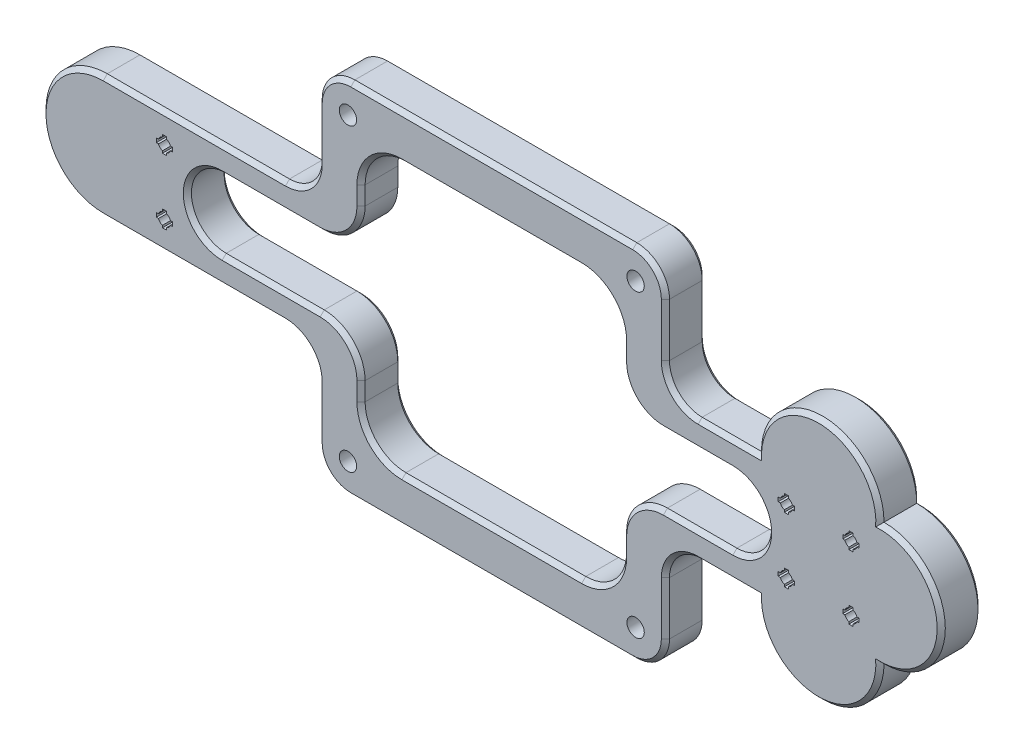
from build123d import *

# Parameters (mm, degrees)
SKETCH1_R           = 2.125
BOSS_EXTRUDE1_DEPTH = 10
FILLET2_R           = 8
CHAMFER1_SIZE       = 1
SKETCH2_R           = 3.5
CUT_EXTRUDE1_DEPTH  = 3
SKETCH3_W           = 64
SKETCH3_H           = 17
SKETCH3_H_2         = 24.5
CUT_EXTRUDE2_DEPTH  = 143.020632304
FILLET3_R           = 10
CHAMFER2_SIZE       = 1


with BuildPart() as part:
    # Sketch1 → Boss-Extrude1 (new body)
    with BuildSketch(Plane.XY):
        with BuildLine():
            Line((-113.1, -31.5), (-60.5, -31.5))
            Line((-60.5, -31.5), (-60.5, -60.5))
            Line((-60.5, -60.5), (24.5, -60.5))
            Line((24.5, -60.5), (24.5, -31.5))
            Line((24.5, -31.5), (47, -31.5))
            ThreePointArc((47, -31.5), (62, -46.5), (77, -31.5))
            ThreePointArc((77, -31.5), (92, -16.5), (77, -1.5))
            ThreePointArc((77, -1.5), (62, 13.5), (47, -1.5))
            Line((47, -1.5), (24.5, -1.5))
            Line((24.5, -1.5), (24.5, 27.5))
            Line((24.5, 27.5), (-60.5, 27.5))
            Line((-60.5, 27.5), (-60.5, -1.5))
            Line((-60.5, -1.5), (-113.1, -1.5))
            ThreePointArc((-113.1, -1.5), (-128.1, -16.5), (-113.1, -31.5))
        make_face()
        with BuildLine():
            Line((-100.1, -24.9), (-100.1, -23.9))
            Line((-100.1, -23.9), (-99.567140075, -23.9))
            ThreePointArc((-99.567140075, -23.9), (-99.196015511, -23.303984489), (-98.6, -22.932859925))
            Line((-98.6, -22.932859925), (-98.6, -22.4))
            Line((-98.6, -22.4), (-97.6, -22.4))
            Line((-97.6, -22.4), (-97.6, -22.932859925))
            ThreePointArc((-97.6, -22.932859925), (-97.003984489, -23.303984489), (-96.632859925, -23.9))
            Line((-96.632859925, -23.9), (-96.1, -23.9))
            Line((-96.1, -23.9), (-96.1, -24.9))
            Line((-96.1, -24.9), (-96.632859925, -24.9))
            ThreePointArc((-96.632859925, -24.9), (-97.003984489, -25.496015511), (-97.6, -25.867140075))
            Line((-97.6, -25.867140075), (-97.6, -26.4))
            Line((-97.6, -26.4), (-98.6, -26.4))
            Line((-98.6, -26.4), (-98.6, -25.867140075))
            ThreePointArc((-98.6, -25.867140075), (-99.196015511, -25.496015511), (-99.567140075, -24.9))
            Line((-99.567140075, -24.9), (-100.1, -24.9))
        make_face(mode=Mode.SUBTRACT)
        with BuildLine():
            Line((-97.6, -10.6), (-98.6, -10.6))
            Line((-98.6, -10.6), (-98.6, -10.067140075))
            ThreePointArc((-98.6, -10.067140075), (-99.196015511, -9.696015511), (-99.567140075, -9.1))
            Line((-99.567140075, -9.1), (-100.1, -9.1))
            Line((-100.1, -9.1), (-100.1, -8.1))
            Line((-100.1, -8.1), (-99.567140075, -8.1))
            ThreePointArc((-99.567140075, -8.1), (-99.196015511, -7.503984489), (-98.6, -7.132859925))
            Line((-98.6, -7.132859925), (-98.6, -6.6))
            Line((-98.6, -6.6), (-97.6, -6.6))
            Line((-97.6, -6.6), (-97.6, -7.132859925))
            ThreePointArc((-97.6, -7.132859925), (-97.003984489, -7.503984489), (-96.632859925, -8.1))
            Line((-96.632859925, -8.1), (-96.1, -8.1))
            Line((-96.1, -8.1), (-96.1, -9.1))
            Line((-96.1, -9.1), (-96.632859925, -9.1))
            ThreePointArc((-96.632859925, -9.1), (-97.003984489, -9.696015511), (-97.6, -10.067140075))
            Line((-97.6, -10.067140075), (-97.6, -10.6))
        make_face(mode=Mode.SUBTRACT)
        with Locations((17.2, 20.2)):
            Circle(SKETCH1_R, mode=Mode.SUBTRACT)
        with Locations((-53.2, -53.2)):
            Circle(SKETCH1_R, mode=Mode.SUBTRACT)
        with Locations((17.2, -53.2)):
            Circle(SKETCH1_R, mode=Mode.SUBTRACT)
        with Locations((-53.2, 20.2)):
            Circle(SKETCH1_R, mode=Mode.SUBTRACT)
        with BuildLine():
            Line((69.4, -10.6), (69.4, -10.067140075))
            ThreePointArc((69.4, -10.067140075), (68.803984489, -9.696015511), (68.432859925, -9.1))
            Line((68.432859925, -9.1), (67.9, -9.1))
            Line((67.9, -9.1), (67.9, -8.1))
            Line((67.9, -8.1), (68.432859925, -8.1))
            ThreePointArc((68.432859925, -8.1), (68.803984489, -7.503984489), (69.4, -7.132859925))
            Line((69.4, -7.132859925), (69.4, -6.6))
            Line((69.4, -6.6), (70.4, -6.6))
            Line((70.4, -6.6), (70.4, -7.132859925))
            ThreePointArc((70.4, -7.132859925), (70.996015511, -7.503984489), (71.367140075, -8.1))
            Line((71.367140075, -8.1), (71.9, -8.1))
            Line((71.9, -8.1), (71.9, -9.1))
            Line((71.9, -9.1), (71.367140075, -9.1))
            ThreePointArc((71.367140075, -9.1), (70.996015511, -9.696015511), (70.4, -10.067140075))
            Line((70.4, -10.067140075), (70.4, -10.6))
            Line((70.4, -10.6), (69.4, -10.6))
        make_face(mode=Mode.SUBTRACT)
        with BuildLine():
            Line((55.567140075, -23.9), (56.1, -23.9))
            Line((56.1, -23.9), (56.1, -24.9))
            Line((56.1, -24.9), (55.567140075, -24.9))
            ThreePointArc((55.567140075, -24.9), (55.196015511, -25.496015511), (54.6, -25.867140075))
            Line((54.6, -25.867140075), (54.6, -26.4))
            Line((54.6, -26.4), (53.6, -26.4))
            Line((53.6, -26.4), (53.6, -25.867140075))
            ThreePointArc((53.6, -25.867140075), (53.003984489, -25.496015511), (52.632859925, -24.9))
            Line((52.632859925, -24.9), (52.1, -24.9))
            Line((52.1, -24.9), (52.1, -23.9))
            Line((52.1, -23.9), (52.632859925, -23.9))
            ThreePointArc((52.632859925, -23.9), (53.003984489, -23.303984489), (53.6, -22.932859925))
            Line((53.6, -22.932859925), (53.6, -22.4))
            Line((53.6, -22.4), (54.6, -22.4))
            Line((54.6, -22.4), (54.6, -22.932859925))
            ThreePointArc((54.6, -22.932859925), (55.196015511, -23.303984489), (55.567140075, -23.9))
        make_face(mode=Mode.SUBTRACT)
        with BuildLine():
            Line((67.9, -24.9), (67.9, -23.9))
            Line((67.9, -23.9), (68.432859925, -23.9))
            ThreePointArc((68.432859925, -23.9), (68.803984489, -23.303984489), (69.4, -22.932859925))
            Line((69.4, -22.932859925), (69.4, -22.4))
            Line((69.4, -22.4), (70.4, -22.4))
            Line((70.4, -22.4), (70.4, -22.932859925))
            ThreePointArc((70.4, -22.932859925), (70.996015511, -23.303984489), (71.367140075, -23.9))
            Line((71.367140075, -23.9), (71.9, -23.9))
            Line((71.9, -23.9), (71.9, -24.9))
            Line((71.9, -24.9), (71.367140075, -24.9))
            ThreePointArc((71.367140075, -24.9), (70.996015511, -25.496015511), (70.4, -25.867140075))
            Line((70.4, -25.867140075), (70.4, -26.4))
            Line((70.4, -26.4), (69.4, -26.4))
            Line((69.4, -26.4), (69.4, -25.867140075))
            ThreePointArc((69.4, -25.867140075), (68.803984489, -25.496015511), (68.432859925, -24.9))
            Line((68.432859925, -24.9), (67.9, -24.9))
        make_face(mode=Mode.SUBTRACT)
        with BuildLine():
            Line((56.1, -8.1), (56.1, -9.1))
            Line((56.1, -9.1), (55.567140075, -9.1))
            ThreePointArc((55.567140075, -9.1), (55.196015511, -9.696015511), (54.6, -10.067140075))
            Line((54.6, -10.067140075), (54.6, -10.6))
            Line((54.6, -10.6), (53.6, -10.6))
            Line((53.6, -10.6), (53.6, -10.067140075))
            ThreePointArc((53.6, -10.067140075), (53.003984489, -9.696015511), (52.632859925, -9.1))
            Line((52.632859925, -9.1), (52.1, -9.1))
            Line((52.1, -9.1), (52.1, -8.1))
            Line((52.1, -8.1), (52.632859925, -8.1))
            ThreePointArc((52.632859925, -8.1), (53.003984489, -7.503984489), (53.6, -7.132859925))
            Line((53.6, -7.132859925), (53.6, -6.6))
            Line((53.6, -6.6), (54.6, -6.6))
            Line((54.6, -6.6), (54.6, -7.132859925))
            ThreePointArc((54.6, -7.132859925), (55.196015511, -7.503984489), (55.567140075, -8.1))
            Line((55.567140075, -8.1), (56.1, -8.1))
        make_face(mode=Mode.SUBTRACT)
    extrude(amount=BOSS_EXTRUDE1_DEPTH)

    # Fillet2
    fillet2_edges = [part.edges().sort_by_distance(p)[0] for p in [
        (-60.5, -1.5, 5),
        (-60.5, 27.5, 5),
        (24.5, 27.5, 5),
        (24.5, -1.5, 5),
        (24.5, -31.5, 5),
        (24.5, -60.5, 5),
        (-60.5, -60.5, 5),
        (-60.5, -31.5, 5),
    ]]
    fillet(fillet2_edges, radius=FILLET2_R)

    # Chamfer1
    chamfer1_edges = [part.edges().sort_by_distance(p)[0] for p in [
        (-128.1, -16.5, 10),
        (62, 13.5, 0),
        (92, -16.5, 0),
        (62, -46.5, 0),
        (-90.8, -31.5, 10),
        (-60.5, 13, 10),
        (-18, 27.5, 10),
        (-60.5, -46, 10),
        (-18, -60.5, 10),
        (24.5, -46, 10),
        (24.5, 13, 10),
        (-58.156854249, -58.156854249, 10),
        (22.156854249, -58.156854249, 10),
        (22.156854249, 25.156854249, 10),
        (-58.156854249, 25.156854249, 10),
        (-62.843145751, 0.843145751, 10),
        (26.843145751, 0.843145751, 10),
        (26.843145751, -33.843145751, 10),
        (-62.843145751, -33.843145751, 10),
        (39.75, -31.5, 10),
        (62, -46.5, 10),
        (92, -16.5, 10),
        (62, 13.5, 10),
        (39.75, -1.5, 10),
        (-90.8, -1.5, 10),
    ]]
    chamfer(chamfer1_edges, length=CHAMFER1_SIZE)

    # Sketch2 → Cut-Extrude1 (cut)
    with BuildSketch(Plane(origin=(0, 0, 0), x_dir=(-1, 0, 0), z_dir=(0, 0, -1))):
        with Locations((-17.2, 20.2)):
            Circle(SKETCH2_R)
        with Locations((-17.2, -53.2)):
            Circle(SKETCH2_R)
        with Locations((53.2, -53.2)):
            Circle(SKETCH2_R)
        with Locations((53.2, 20.2)):
            Circle(SKETCH2_R)
    extrude(amount=-CUT_EXTRUDE1_DEPTH, mode=Mode.SUBTRACT)

    # Sketch3 → Cut-Extrude2 (cut, through all)
    with BuildSketch(Plane.XY.offset(10)):
        with BuildLine():
            Line((-50, -8), (-84, -8))
            ThreePointArc((-84, -8), (-92.5, -16.5), (-84, -25))
            Line((-84, -25), (-50, -25))
            Line((-50, -25), (-50, -8))
        make_face()
        with Locations((-18, -16.5)):
            Rectangle(SKETCH3_W, SKETCH3_H)
        with Locations((-18, 4.25)):
            Rectangle(SKETCH3_W, SKETCH3_H_2)
        with Locations((-18, -37.25)):
            Rectangle(SKETCH3_W, SKETCH3_H_2)
        with BuildLine():
            Line((41, -8), (14, -8))
            Line((14, -8), (14, -25))
            Line((14, -25), (41, -25))
            ThreePointArc((41, -25), (49.5, -16.5), (41, -8))
        make_face()
    extrude(amount=-CUT_EXTRUDE2_DEPTH, mode=Mode.SUBTRACT)

    # Fillet3
    fillet3_edges = [part.edges().sort_by_distance(p)[0] for p in [
        (-50, -8, 5),
        (-50, 16.5, 5),
        (14, 16.5, 5),
        (14, -8, 5),
        (14, -25, 5),
        (14, -49.5, 5),
        (-50, -49.5, 5),
        (-50, -25, 5),
    ]]
    fillet(fillet3_edges, radius=FILLET3_R)

    # Chamfer2
    chamfer2_edges = [part.edges().sort_by_distance(p)[0] for p in [
        (-72, -8, 0),
        (-72, -8, 10),
        (32.5, -8, 10),
        (32.5, -8, 0),
        (-92.5, -16.5, 10),
        (-92.5, -16.5, 0),
        (49.5, -16.5, 10),
        (49.5, -16.5, 0),
        (32.5, -25, 0),
        (32.5, -25, 10),
        (-72, -25, 10),
        (-72, -25, 0),
        (16.928932188, -5.071067812, 0),
        (16.928932188, -5.071067812, 10),
        (14, 4.25, 10),
        (14, 4.25, 0),
        (11.071067812, 13.571067812, 0),
        (11.071067812, 13.571067812, 10),
        (16.928932188, -27.928932188, 0),
        (16.928932188, -27.928932188, 10),
        (-18, 16.5, 0),
        (-18, 16.5, 10),
        (14, -37.25, 0),
        (14, -37.25, 10),
        (-47.071067812, 13.571067812, 0),
        (-47.071067812, 13.571067812, 10),
        (11.071067812, -46.571067812, 0),
        (11.071067812, -46.571067812, 10),
        (-50, 4.25, 10),
        (-50, 4.25, 0),
        (-18, -49.5, 10),
        (-18, -49.5, 0),
        (-52.928932188, -5.071067812, 0),
        (-52.928932188, -5.071067812, 10),
        (-47.071067812, -46.571067812, 0),
        (-47.071067812, -46.571067812, 10),
        (-50, -37.25, 10),
        (-50, -37.25, 0),
        (-52.928932188, -27.928932188, 0),
        (-52.928932188, -27.928932188, 10),
        (40.25, -1.5, 0),
        (40.25, -31.5, 0),
        (26.843145751, 0.843145751, 0),
        (26.843145751, -33.843145751, 0),
        (24.5, 13, 0),
        (24.5, -46, 0),
        (22.156854249, 25.156854249, 0),
        (22.156854249, -58.156854249, 0),
        (-18, 27.5, 0),
        (-18, -60.5, 0),
        (-58.156854249, 25.156854249, 0),
        (-58.156854249, -58.156854249, 0),
        (-60.5, 13, 0),
        (-60.5, -46, 0),
        (-62.843145751, 0.843145751, 0),
        (-62.843145751, -33.843145751, 0),
        (-90.8, -1.5, 0),
        (-90.8, -31.5, 0),
        (-128.1, -16.5, 0),
    ]]
    chamfer(chamfer2_edges, length=CHAMFER2_SIZE)


solid = part.part
